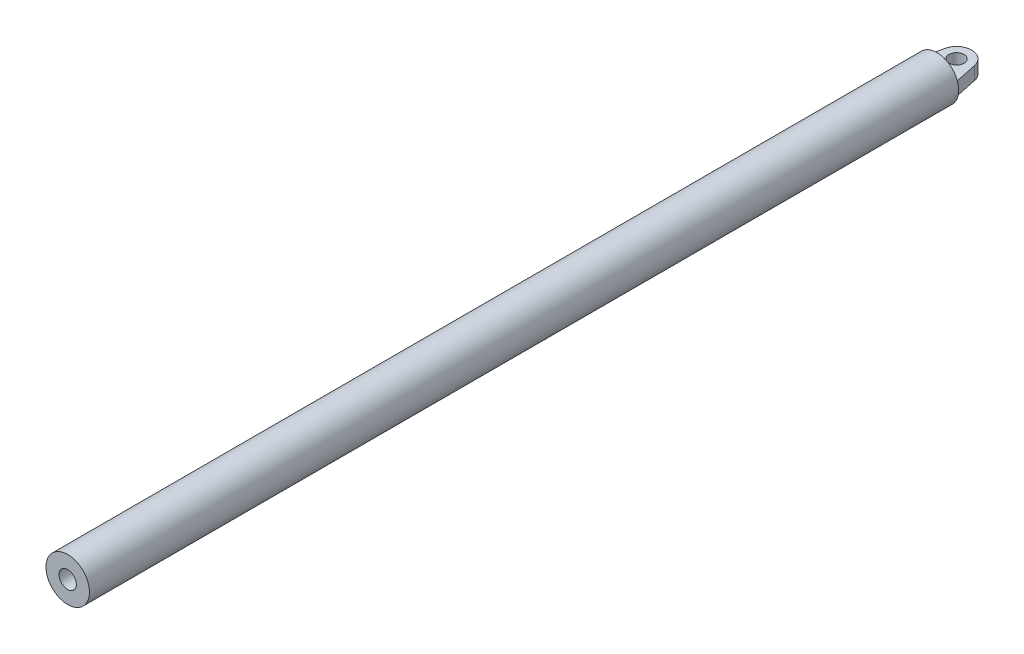
from build123d import *

# Parameters (mm, degrees)
SKETCH1_R           = 50
BOSS_EXTRUDE1_DEPTH = 2000
SHELL1_T            = -30
BOSS_EXTRUDE2_DEPTH = 15


with BuildPart() as part:
    # Sketch1 → Boss-Extrude1 (new body)
    with BuildSketch(Plane.XY):
        Circle(SKETCH1_R)
    extrude(amount=BOSS_EXTRUDE1_DEPTH)

    # Shell1
    shell1_openings = [part.faces().sort_by_distance(p)[0] for p in [
        (0, 0, 2000),
    ]]
    offset(amount=SHELL1_T, openings=shell1_openings, kind=Kind.INTERSECTION)

    # Sketch2 → Boss-Extrude2 (add, symmetric)
    with BuildSketch(Plane(origin=(0, 0, 0), x_dir=(1, 0, 0), z_dir=(0, 1, 0))):
        with BuildLine():
            Line((-34.28083908, 52.058616858), (-45, 0))
            Line((-45, 0), (0, 0))
            Line((0, 0), (0, 27.5))
            ThreePointArc((0, 27.5), (-17.5, 45), (0, 62.5))
            Line((0, 62.5), (0, 80))
            ThreePointArc((0, 80), (-22.112761134, 72.129795337), (-34.28083908, 52.058616858))
        make_face()
        with BuildLine():
            Line((0, 27.5), (0, 0))
            Line((0, 0), (45, 0))
            Line((45, 0), (34.28083908, 52.058616858))
            ThreePointArc((34.28083908, 52.058616858), (22.112761134, 72.129795337), (0, 80))
            Line((0, 80), (0, 62.5))
            ThreePointArc((0, 62.5), (12.374368671, 57.374368671), (17.5, 45))
            ThreePointArc((17.5, 45), (12.374368671, 32.625631329), (0, 27.5))
        make_face()
    extrude(amount=BOSS_EXTRUDE2_DEPTH, both=True)


solid = part.part
